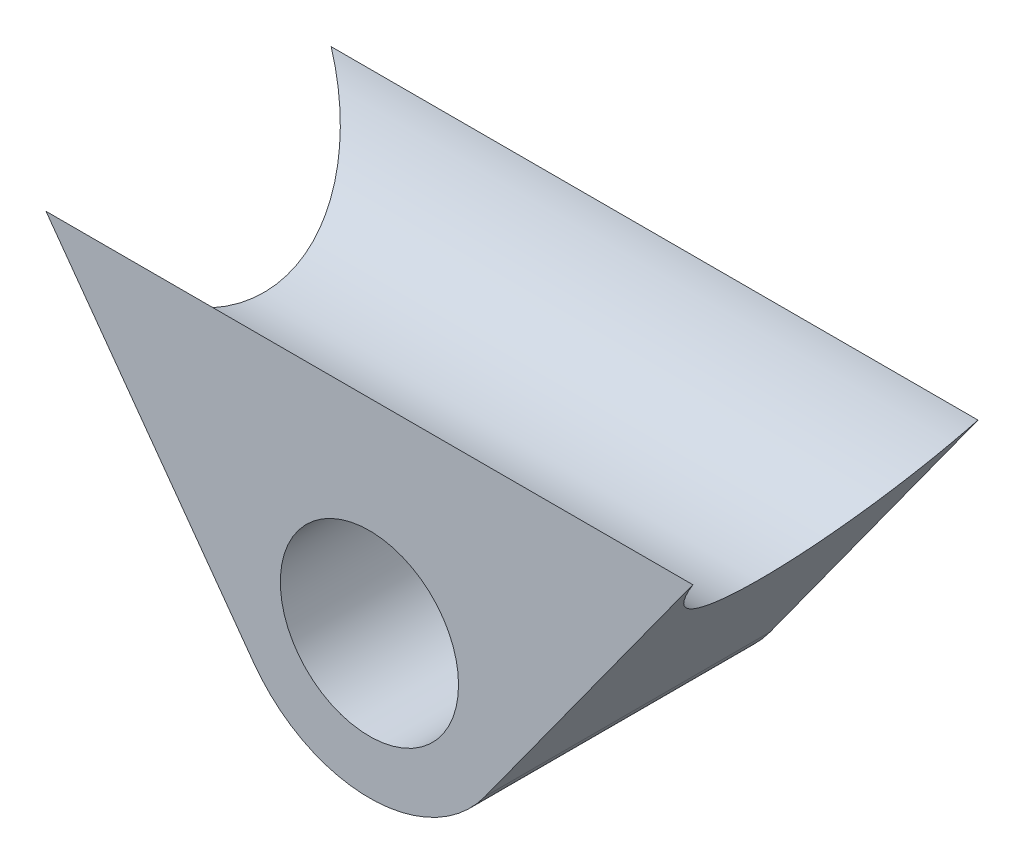
from build123d import *

# Parameters (mm, degrees)
EXTRUDE1_START = 25.4
SKETCH1_R      = 7.9375
EXTRUDE1_DEPTH = 25.4
SKETCH2_R      = 13.335
EXTRUDE3_DEPTH = 73.025


with BuildPart() as part:
    # Sketch1 → Extrude1 (new body)
    with BuildSketch(Plane.XY.offset(EXTRUDE1_START)):
        with BuildLine():
            Line((-10.290233655, -7.443190936), (-31.75, 22.225))
            Line((-31.75, 22.225), (31.75, 22.225))
            Line((31.75, 22.225), (10.290233655, -7.443190936))
            ThreePointArc((10.290233655, -7.443190936), (0, -12.7), (-10.290233655, -7.443190936))
        make_face()
        Circle(SKETCH1_R, mode=Mode.SUBTRACT)
    extrude(amount=-EXTRUDE1_DEPTH)

    # Sketch2 → Extrude3 (cut, symmetric)
    with BuildSketch(Plane(origin=(0, 0, 0), x_dir=(0, 0, -1), z_dir=(1, 0, 0))):
        with Locations((-12.7, 22.225)):
            Circle(SKETCH2_R)
    extrude(amount=EXTRUDE3_DEPTH, both=True, mode=Mode.SUBTRACT)


solid = part.part
